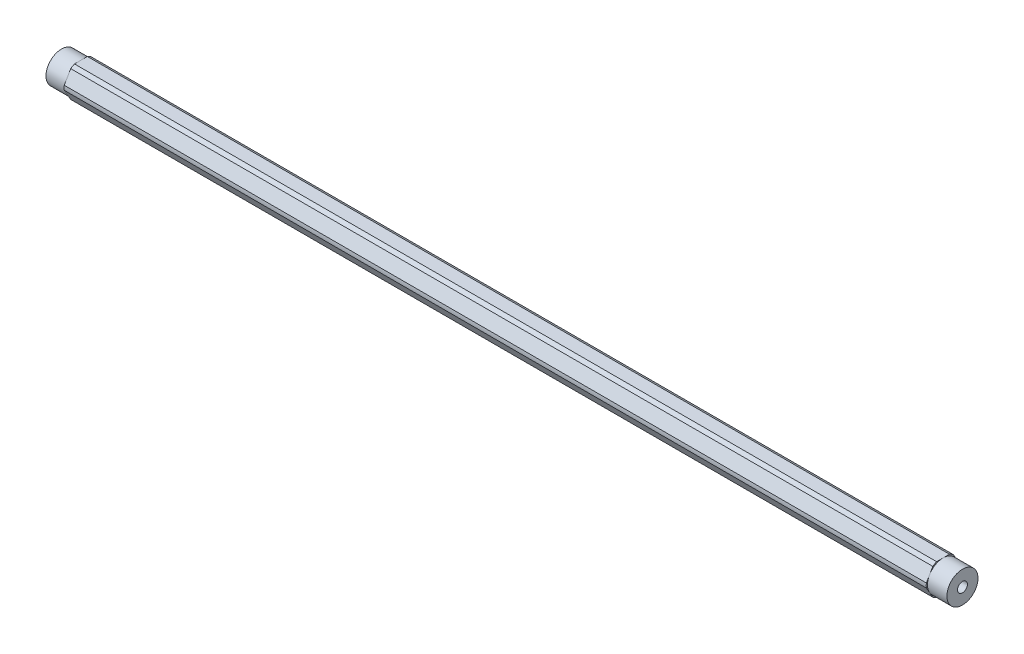
from build123d import *

# Parameters (mm, degrees)
SKETCH1_R                            = 2.0193
BOSS_EXTRUDE1_DEPTH                  = 184.15
F_10_32_TAPPED_HOLE1_D               = 4.0386
F_10_32_TAPPED_HOLE1_DEPTH           = 16.34744
F_10_32_TAPPED_HOLE1_TIP             = 1.213317848
F_10_32_TAPPED_HOLE1_ON_FACE_2_D     = 4.0386
F_10_32_TAPPED_HOLE1_ON_FACE_2_DEPTH = 16.34744
F_10_32_TAPPED_HOLE1_ON_FACE_2_TIP   = 1.213317848
SKETCH3_R                            = 8.89
SKETCH3_R_2                          = 6.35
CUT_EXTRUDE_THIN1_DEPTH              = 7.9375


with BuildPart() as part:
    # Sketch1 → Boss-Extrude1 (new, symmetric)
    with BuildSketch(Plane(origin=(0, 0, 0), x_dir=(0, 0, -1), z_dir=(1, 0, 0))):
        with BuildLine():
            ThreePointArc((4.181770846, 5.456960429), (3.437499983, 5.953924622), (2.634980936, 6.35))
            Line((2.634980936, 6.35), (-2.634980936, 6.35))
            ThreePointArc((-2.634980936, 6.35), (-3.437499983, 5.953924622), (-4.181770846, 5.456960429))
            Line((-4.181770846, 5.456960429), (-6.816751782, 0.893039571))
            ThreePointArc((-6.816751782, 0.893039571), (-6.874999966, 0), (-6.816751782, -0.893039571))
            Line((-6.816751782, -0.893039571), (-4.181770846, -5.456960429))
            ThreePointArc((-4.181770846, -5.456960429), (-3.437499983, -5.953924622), (-2.634980936, -6.35))
            Line((-2.634980936, -6.35), (2.634980936, -6.35))
            ThreePointArc((2.634980936, -6.35), (3.437499983, -5.953924622), (4.181770846, -5.456960429))
            Line((4.181770846, -5.456960429), (6.816751782, -0.893039571))
            ThreePointArc((6.816751782, -0.893039571), (6.860422465, -0.447468582), (6.874999966, 0))
            ThreePointArc((6.874999966, 0), (6.860422465, 0.447468582), (6.816751782, 0.893039571))
            Line((6.816751782, 0.893039571), (4.181770846, 5.456960429))
        make_face()
        Circle(SKETCH1_R, mode=Mode.SUBTRACT)
    extrude(amount=BOSS_EXTRUDE1_DEPTH, both=True)

    # #10-32 Tapped Hole1
    with Locations(Plane(origin=(184.15, 0, 0), x_dir=(0, 0, 1), z_dir=(1, 0, 0))):
        with Locations((0, 0)):
            Hole(F_10_32_TAPPED_HOLE1_D / 2, depth=F_10_32_TAPPED_HOLE1_DEPTH)
            with Locations((0, 0, -(F_10_32_TAPPED_HOLE1_DEPTH + F_10_32_TAPPED_HOLE1_TIP / 2))):  # 118° drill point
                Cone(0, F_10_32_TAPPED_HOLE1_D / 2, F_10_32_TAPPED_HOLE1_TIP, mode=Mode.SUBTRACT)

    # #10-32 Tapped Hole1 on face 2
    with Locations(Plane(origin=(-184.15, 0, 0), x_dir=(0, 0, 1), z_dir=(1, 0, 0))):
        with Locations((0, 0)):
            Hole(F_10_32_TAPPED_HOLE1_ON_FACE_2_D / 2, depth=F_10_32_TAPPED_HOLE1_ON_FACE_2_DEPTH)
            with Locations((0, 0, -(F_10_32_TAPPED_HOLE1_ON_FACE_2_DEPTH + F_10_32_TAPPED_HOLE1_ON_FACE_2_TIP / 2))):  # 118° drill point
                Cone(0, F_10_32_TAPPED_HOLE1_ON_FACE_2_D / 2, F_10_32_TAPPED_HOLE1_ON_FACE_2_TIP, mode=Mode.SUBTRACT)

    # Sketch3 → Cut-Extrude-Thin1 (cut)
    with BuildSketch(Plane(origin=(184.15, 0, 0), x_dir=(0, 0, -1), z_dir=(1, 0, 0))):
        Circle(SKETCH3_R)
        Circle(SKETCH3_R_2, mode=Mode.SUBTRACT)
    cut_extrude_thin1 = extrude(amount=-CUT_EXTRUDE_THIN1_DEPTH, mode=Mode.SUBTRACT)

    # Mirror1: Cut-Extrude-Thin1 across plane
    add(cut_extrude_thin1.mirror(Plane(origin=(0, 0, 0), x_dir=(0, 0, 1), z_dir=(1, 0, 0))), mode=Mode.SUBTRACT)


solid = part.part
